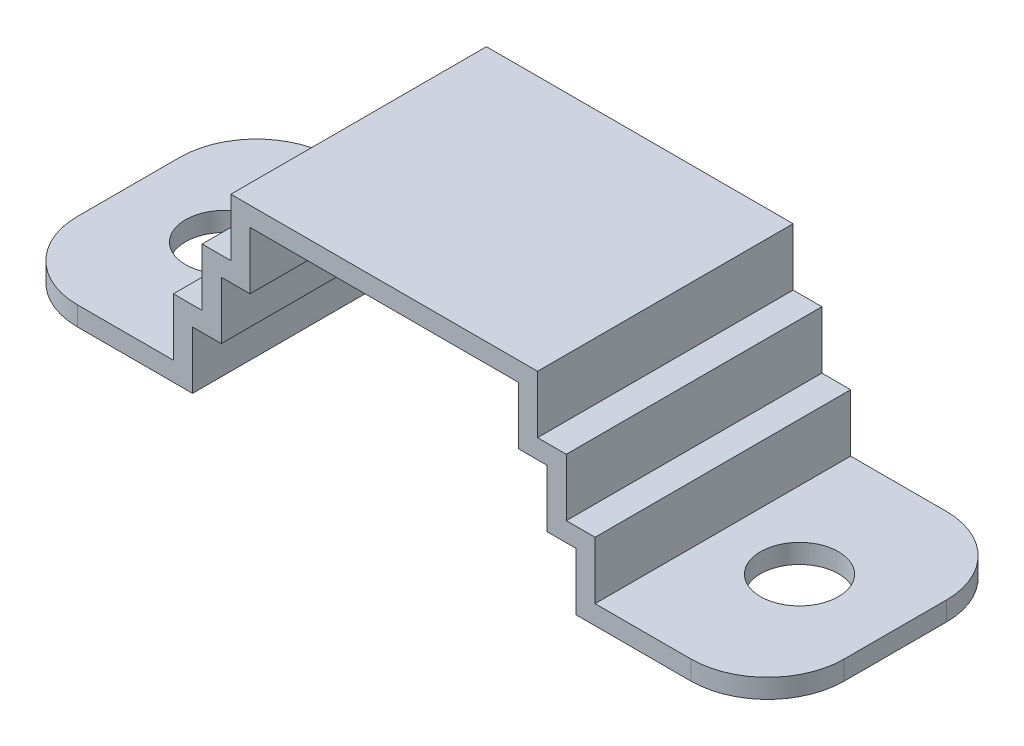
from build123d import *

# Parameters (mm, degrees)
EXTRUDE_THIN1_DEPTH = 20
SKETCH4_R           = 6.1
CUT_EXTRUDE3_DEPTH  = 69.767724988
FILLET1_R           = 12


with BuildPart() as part:
    # Sketch1 → Extrude-Thin1 (new, symmetric)
    with BuildSketch(Plane.XY):
        Polygon((-60, 0), (-30, 0), (-30, 9), (-25.5, 9), (-25.5, 18), (-21, 18), (-21, 27), (0, 27), (0, 30), (-24, 30), (-24, 21), (-28.5, 21), (-28.5, 12), (-33, 12), (-33, 3), (-60, 3), align=None)
    extrude_thin1 = extrude(amount=EXTRUDE_THIN1_DEPTH, both=True)

    # Mirror1: Extrude-Thin1 across plane
    add(extrude_thin1.mirror(Plane(origin=(0, 30, -20), x_dir=(0, 0, 1), z_dir=(-1, 0, 0))))

    # Sketch4 → Cut-Extrude3 (cut, through all)
    with BuildSketch(Plane(origin=(0, 3, 0), x_dir=(1, 0, 0), z_dir=(0, 1, 0))):
        with Locations(Location((-45, 0, 0), (0, 0, 270))):
            Circle(SKETCH4_R)
    cut_extrude3 = extrude(amount=-CUT_EXTRUDE3_DEPTH, mode=Mode.SUBTRACT)

    # Mirror3: Cut-Extrude3 across plane
    add(cut_extrude3.mirror(Plane(origin=(0, 0, 0), x_dir=(0, 0, 1), z_dir=(1, 0, 0))), mode=Mode.SUBTRACT)

    # Fillet1
    fillet1_edges = [part.edges().sort_by_distance(p)[0] for p in [
        (-60, 1.5, 20),
        (-60, 1.5, -20),
        (60, 1.5, -20),
        (60, 1.5, 20),
    ]]
    fillet(fillet1_edges, radius=FILLET1_R)


solid = part.part
